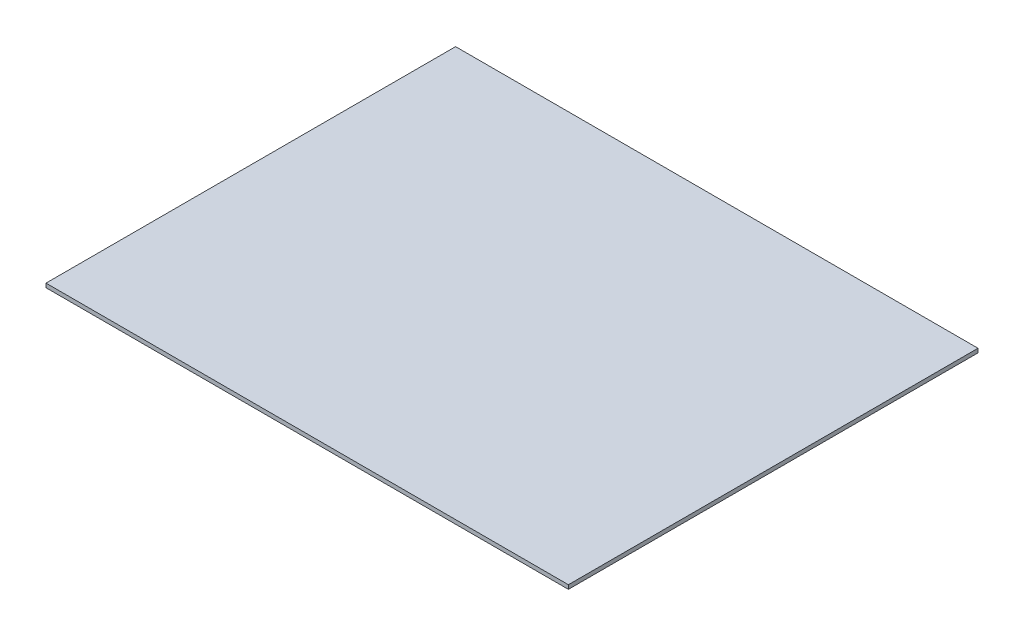
from build123d import *

# Parameters (mm, degrees)
SKETCH1_W           = 389
SKETCH1_H           = 305
BOSS_EXTRUDE1_DEPTH = 3


with BuildPart() as part:
    # Sketch1 → Boss-Extrude1 (new body)
    with BuildSketch(Plane(origin=(0, 0, 0), x_dir=(1, 0, 0), z_dir=(0, 1, 0))):
        Rectangle(SKETCH1_W, SKETCH1_H)
    extrude(amount=BOSS_EXTRUDE1_DEPTH)


solid = part.part
